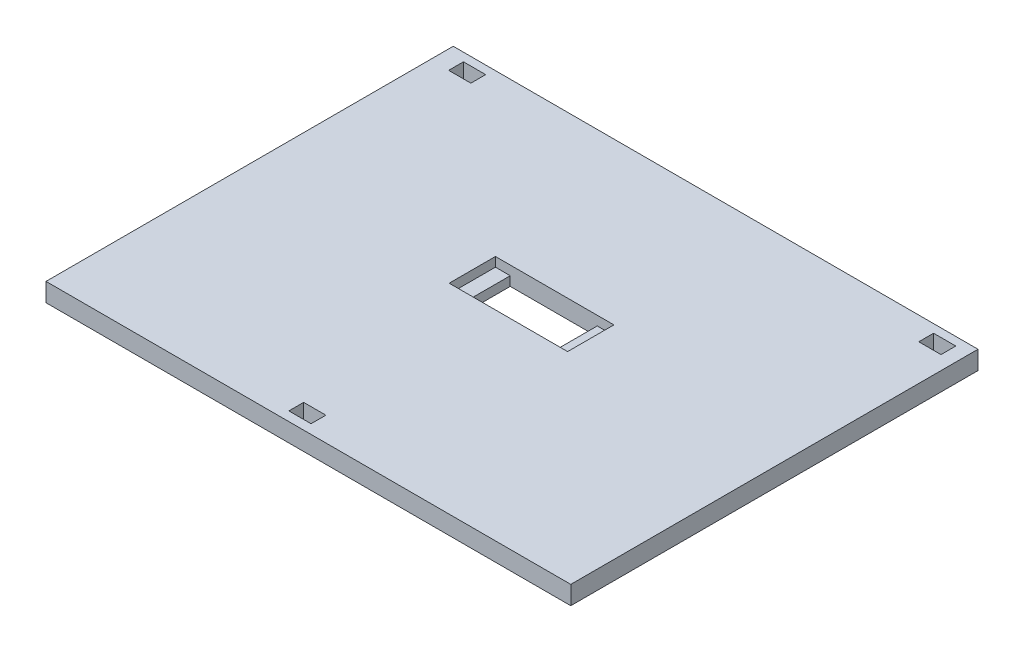
from build123d import *

# Parameters (mm, degrees)
SKETCH3_W           = 144.018
SKETCH3_H           = 111.76
BOSS_EXTRUDE2_DEPTH = 5.08
SKETCH5_W           = 6.096
SKETCH5_H           = 4.064
CUT_EXTRUDE1_DEPTH  = 5.08
SKETCH6_W           = 32.512
SKETCH6_H           = 12.7
CUT_EXTRUDE2_DEPTH  = 2.54
SKETCH7_W           = 23.876
SKETCH7_H           = 12.7
CUT_EXTRUDE3_DEPTH  = 2.54


with BuildPart() as part:
    # Sketch3 → Boss-Extrude2 (new body)
    with BuildSketch(Plane(origin=(0, 0, 0), x_dir=(1, 0, 0), z_dir=(0, 1, 0))):
        with Locations((-10.674968857, -20.111055569)):
            Rectangle(SKETCH3_W, SKETCH3_H)
    extrude(amount=BOSS_EXTRUDE2_DEPTH)

    # Sketch5 → Cut-Extrude1 (cut)
    with BuildSketch(Plane(origin=(0, 5.08, 0), x_dir=(1, 0, 0), z_dir=(0, 1, 0))):
        with Locations((-74.544129387, 31.450944431)):
            Rectangle(SKETCH5_W, SKETCH5_H)
        with Locations((54.476031143, 31.450944431)):
            Rectangle(SKETCH5_W, SKETCH5_H)
        with Locations((-15.53142752, -71.419055569)):
            Rectangle(SKETCH5_W, SKETCH5_H)
    extrude(amount=-CUT_EXTRUDE1_DEPTH, mode=Mode.SUBTRACT)

    # Sketch6 → Cut-Extrude2 (cut)
    with BuildSketch(Plane(origin=(0, 5.08, 0), x_dir=(1, 0, 0), z_dir=(0, 1, 0))):
        with Locations((-10.674968857, -14.750552476)):
            Rectangle(SKETCH6_W, SKETCH6_H)
    extrude(amount=-CUT_EXTRUDE2_DEPTH, mode=Mode.SUBTRACT)

    # Sketch7 → Cut-Extrude3 (cut)
    with BuildSketch(Plane(origin=(0, 2.54, 0), x_dir=(1, 0, 0), z_dir=(0, 1, 0))):
        with Locations((-10.928968857, -14.750552476)):
            Rectangle(SKETCH7_W, SKETCH7_H)
    extrude(amount=-CUT_EXTRUDE3_DEPTH, mode=Mode.SUBTRACT)


solid = part.part
